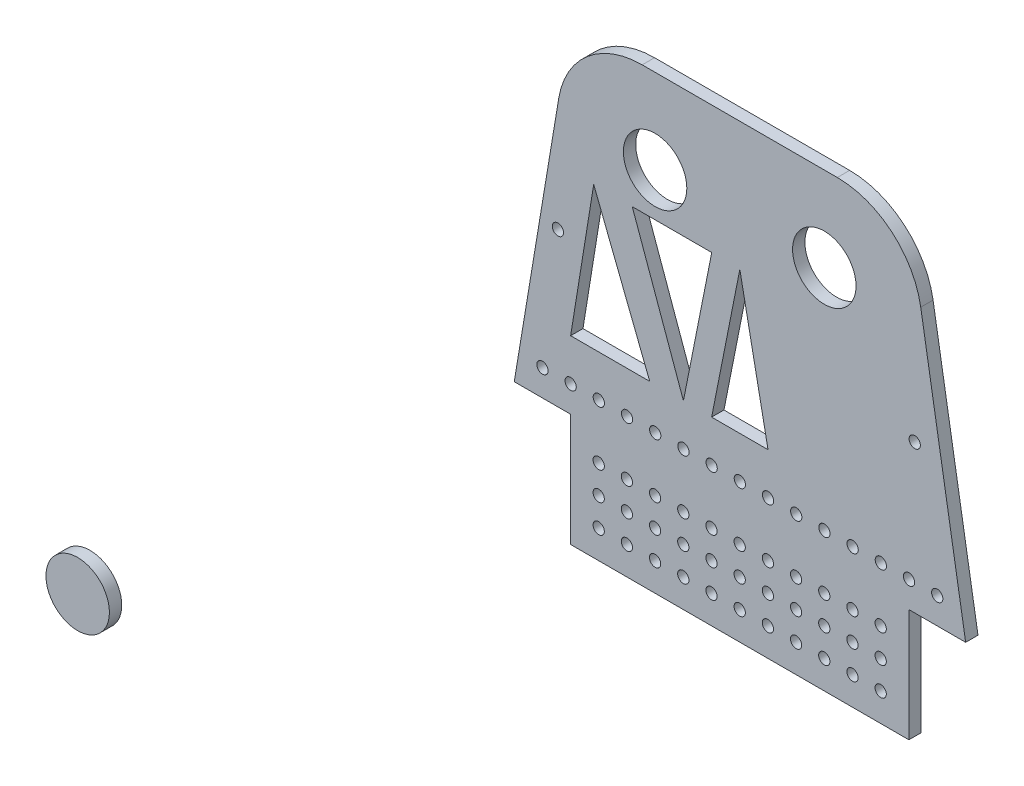
from build123d import *

# Parameters (mm, degrees)
SKETCH2_R             = 14.2875
BOSS_EXTRUDE1_DEPTH   = 5.55625
SKETCH2_R_2           = 2.54
BOSS_EXTRUDE1_2_DEPTH = 5.55625
FILLET1_R             = 38.1


with BuildPart() as part:
    # Sketch2 → Boss-Extrude1 (new body)
    with BuildSketch(Plane.XY):
        with Locations((-255.167526859, -304.167287888)):
            Circle(SKETCH2_R)
    extrude(amount=BOSS_EXTRUDE1_DEPTH)


with BuildPart() as body_2:
    # Sketch2 → Boss-Extrude1 2 (new body)
    with BuildSketch(Plane.XY):
        Polygon((-33.221954044, -123.033671084), (-58.55568732, -123.033671084), (-33.221954044, 29.366328916), (119.178045956, 29.366328916), (144.745882617, -123.033671084), (119.178045956, -123.033671084), (119.178045956, -173.833671084), (-33.221954044, -173.833671084), align=None)
        with Locations((4.878045956, -8.733671084)):
            Circle(SKETCH2_R, mode=Mode.SUBTRACT)
        with Locations((81.078045956, -8.733671084)):
            Circle(SKETCH2_R, mode=Mode.SUBTRACT)
        with Locations((-45.85568732, -111.187710863)):
            Circle(SKETCH2_R_2, mode=Mode.SUBTRACT)
        with Locations((-33.15568732, -111.187710863)):
            Circle(SKETCH2_R_2, mode=Mode.SUBTRACT)
        with Locations((-20.45568732, -111.187710863)):
            Circle(SKETCH2_R_2, mode=Mode.SUBTRACT)
        with Locations((-7.75568732, -111.187710863)):
            Circle(SKETCH2_R_2, mode=Mode.SUBTRACT)
        with Locations((4.94431268, -111.187710863)):
            Circle(SKETCH2_R_2, mode=Mode.SUBTRACT)
        with Locations((17.64431268, -111.187710863)):
            Circle(SKETCH2_R_2, mode=Mode.SUBTRACT)
        with Locations((30.34431268, -111.187710863)):
            Circle(SKETCH2_R_2, mode=Mode.SUBTRACT)
        with Locations((43.04431268, -111.187710863)):
            Circle(SKETCH2_R_2, mode=Mode.SUBTRACT)
        with Locations((55.74431268, -111.187710863)):
            Circle(SKETCH2_R_2, mode=Mode.SUBTRACT)
        with Locations((68.44431268, -111.187710863)):
            Circle(SKETCH2_R_2, mode=Mode.SUBTRACT)
        with Locations((81.14431268, -111.187710863)):
            Circle(SKETCH2_R_2, mode=Mode.SUBTRACT)
        with Locations((93.84431268, -111.187710863)):
            Circle(SKETCH2_R_2, mode=Mode.SUBTRACT)
        with Locations((106.54431268, -111.187710863)):
            Circle(SKETCH2_R_2, mode=Mode.SUBTRACT)
        with Locations((119.24431268, -111.187710863)):
            Circle(SKETCH2_R_2, mode=Mode.SUBTRACT)
        with Locations((131.94431268, -111.187710863)):
            Circle(SKETCH2_R_2, mode=Mode.SUBTRACT)
        with Locations((121.810607633, -56.370137575)):
            Circle(SKETCH2_R_2, mode=Mode.SUBTRACT)
        with Locations((-38.87409027, -53.830137575)):
            Circle(SKETCH2_R_2, mode=Mode.SUBTRACT)
        with Locations((-20.521954044, -161.133671084)):
            Circle(SKETCH2_R_2, mode=Mode.SUBTRACT)
        with Locations((-7.821954044, -161.133671084)):
            Circle(SKETCH2_R_2, mode=Mode.SUBTRACT)
        with Locations((4.878045956, -161.133671084)):
            Circle(SKETCH2_R_2, mode=Mode.SUBTRACT)
        with Locations((17.578045956, -161.133671084)):
            Circle(SKETCH2_R_2, mode=Mode.SUBTRACT)
        with Locations((30.278045956, -161.133671084)):
            Circle(SKETCH2_R_2, mode=Mode.SUBTRACT)
        with Locations((42.978045956, -161.133671084)):
            Circle(SKETCH2_R_2, mode=Mode.SUBTRACT)
        with Locations((55.678045956, -161.133671084)):
            Circle(SKETCH2_R_2, mode=Mode.SUBTRACT)
        with Locations((68.378045956, -161.133671084)):
            Circle(SKETCH2_R_2, mode=Mode.SUBTRACT)
        with Locations((81.078045956, -161.133671084)):
            Circle(SKETCH2_R_2, mode=Mode.SUBTRACT)
        with Locations((93.778045956, -161.133671084)):
            Circle(SKETCH2_R_2, mode=Mode.SUBTRACT)
        with Locations((106.478045956, -161.133671084)):
            Circle(SKETCH2_R_2, mode=Mode.SUBTRACT)
        with Locations((-7.821954044, -148.433671084)):
            Circle(SKETCH2_R_2, mode=Mode.SUBTRACT)
        with Locations((4.878045956, -148.433671084)):
            Circle(SKETCH2_R_2, mode=Mode.SUBTRACT)
        with Locations((17.578045956, -148.433671084)):
            Circle(SKETCH2_R_2, mode=Mode.SUBTRACT)
        with Locations((30.278045956, -148.433671084)):
            Circle(SKETCH2_R_2, mode=Mode.SUBTRACT)
        with Locations((42.978045956, -148.433671084)):
            Circle(SKETCH2_R_2, mode=Mode.SUBTRACT)
        with Locations((55.678045956, -148.433671084)):
            Circle(SKETCH2_R_2, mode=Mode.SUBTRACT)
        with Locations((68.378045956, -148.433671084)):
            Circle(SKETCH2_R_2, mode=Mode.SUBTRACT)
        with Locations((81.078045956, -148.433671084)):
            Circle(SKETCH2_R_2, mode=Mode.SUBTRACT)
        with Locations((93.778045956, -148.433671084)):
            Circle(SKETCH2_R_2, mode=Mode.SUBTRACT)
        with Locations((106.478045956, -148.433671084)):
            Circle(SKETCH2_R_2, mode=Mode.SUBTRACT)
        with Locations((-7.821954044, -135.733671084)):
            Circle(SKETCH2_R_2, mode=Mode.SUBTRACT)
        with Locations((4.878045956, -135.733671084)):
            Circle(SKETCH2_R_2, mode=Mode.SUBTRACT)
        with Locations((17.578045956, -135.733671084)):
            Circle(SKETCH2_R_2, mode=Mode.SUBTRACT)
        with Locations((30.278045956, -135.733671084)):
            Circle(SKETCH2_R_2, mode=Mode.SUBTRACT)
        with Locations((42.978045956, -135.733671084)):
            Circle(SKETCH2_R_2, mode=Mode.SUBTRACT)
        with Locations((55.678045956, -135.733671084)):
            Circle(SKETCH2_R_2, mode=Mode.SUBTRACT)
        with Locations((68.378045956, -135.733671084)):
            Circle(SKETCH2_R_2, mode=Mode.SUBTRACT)
        with Locations((81.078045956, -135.733671084)):
            Circle(SKETCH2_R_2, mode=Mode.SUBTRACT)
        with Locations((93.778045956, -135.733671084)):
            Circle(SKETCH2_R_2, mode=Mode.SUBTRACT)
        with Locations((106.478045956, -135.733671084)):
            Circle(SKETCH2_R_2, mode=Mode.SUBTRACT)
        with Locations((-20.521954044, -148.433671084)):
            Circle(SKETCH2_R_2, mode=Mode.SUBTRACT)
        with Locations((-20.521954044, -135.733671084)):
            Circle(SKETCH2_R_2, mode=Mode.SUBTRACT)
        Polygon((-22.767796965, -28.16783361), (-33.15568732, -92.394571291), (2.468038836, -92.394571291), align=None, mode=Mode.SUBTRACT)
        Polygon((43.04431268, -28.399699089), (55.74431268, -92.394571291), (30.34431268, -92.394571291), align=None, mode=Mode.SUBTRACT)
        Polygon((17.64431268, -92.394571291), (30.390327173, -28.16783361), (-5.41538745, -28.16783361), align=None, mode=Mode.SUBTRACT)
    extrude(amount=BOSS_EXTRUDE1_2_DEPTH)

    # Fillet1
    fillet1_edges = [body_2.edges().sort_by_distance(p)[0] for p in [
        (-33.221954044, 29.366328916, 2.778125),
        (119.178045956, 29.366328916, 2.778125),
    ]]
    fillet(fillet1_edges, radius=FILLET1_R)


solid = Compound([part.part, body_2.part])
